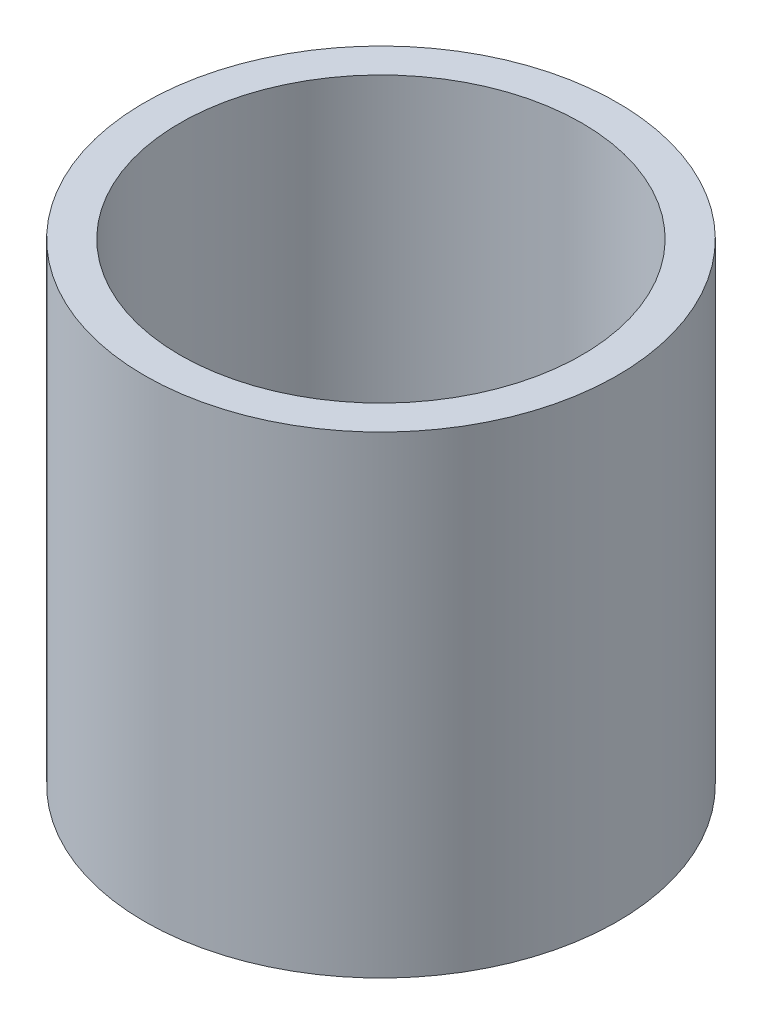
from build123d import *

# Parameters (mm, degrees)
SKETCH_1_R      = 20
SKETCH_1_R_2    = 17
EXTRUDE_1_DEPTH = 40


with BuildPart() as part:
    # 스케치1 → 보스-돌출1 (new body)
    with BuildSketch(Plane(origin=(0, 0, 0), x_dir=(1, 0, 0), z_dir=(0, 1, 0))):
        with Locations(Location((0, 0, 0), (0, 0, 270))):
            Circle(SKETCH_1_R)
        with Locations(Location((0, 0, 0), (0, 0, 270))):
            Circle(SKETCH_1_R_2, mode=Mode.SUBTRACT)
    extrude(amount=EXTRUDE_1_DEPTH)


solid = part.part
